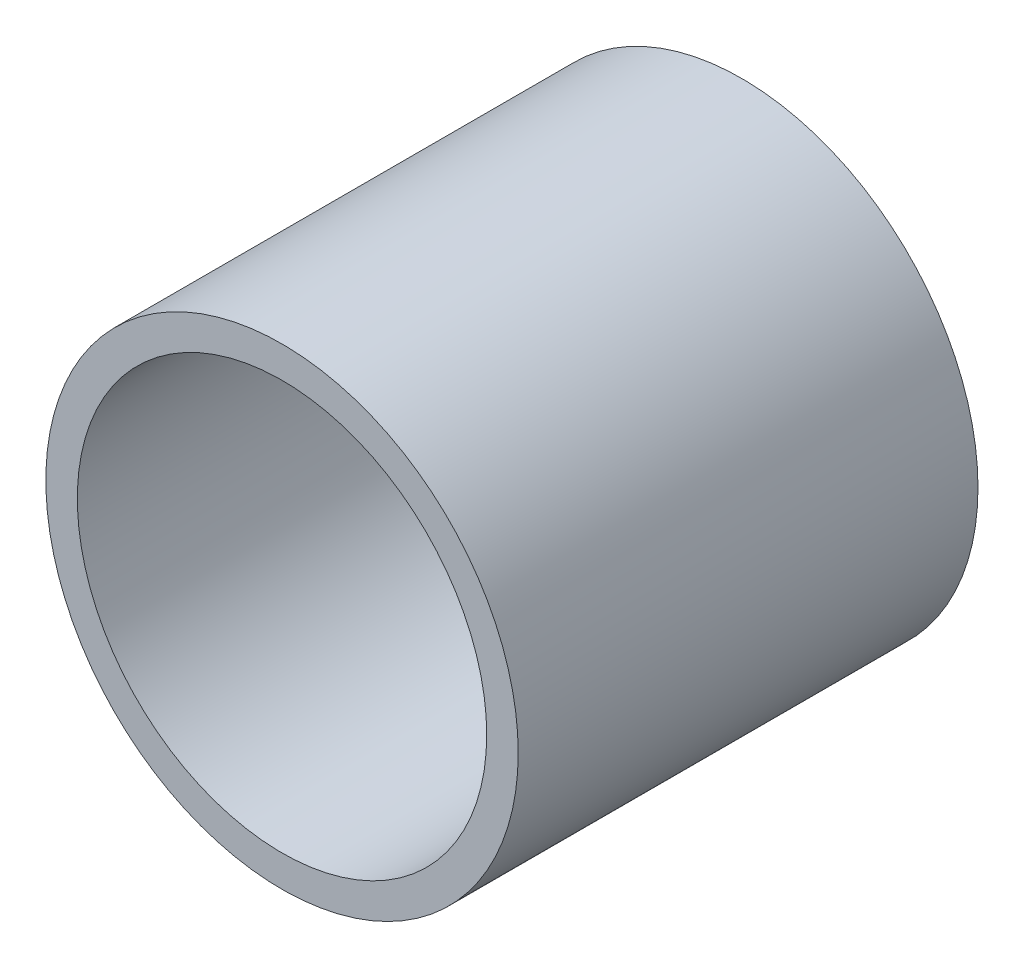
from build123d import *

# Parameters (mm, degrees)
SKETCH_1_R      = 3.75
SKETCH_1_R_2    = 3.25
EXTRUDE_1_DEPTH = 7.3


with BuildPart() as part:
    # ｽｹｯﾁ1 → ﾎﾞｽ - 押し出し1 (new body)
    with BuildSketch(Plane.XY):
        Circle(SKETCH_1_R)
        Circle(SKETCH_1_R_2, mode=Mode.SUBTRACT)
    extrude(amount=EXTRUDE_1_DEPTH)


solid = part.part
